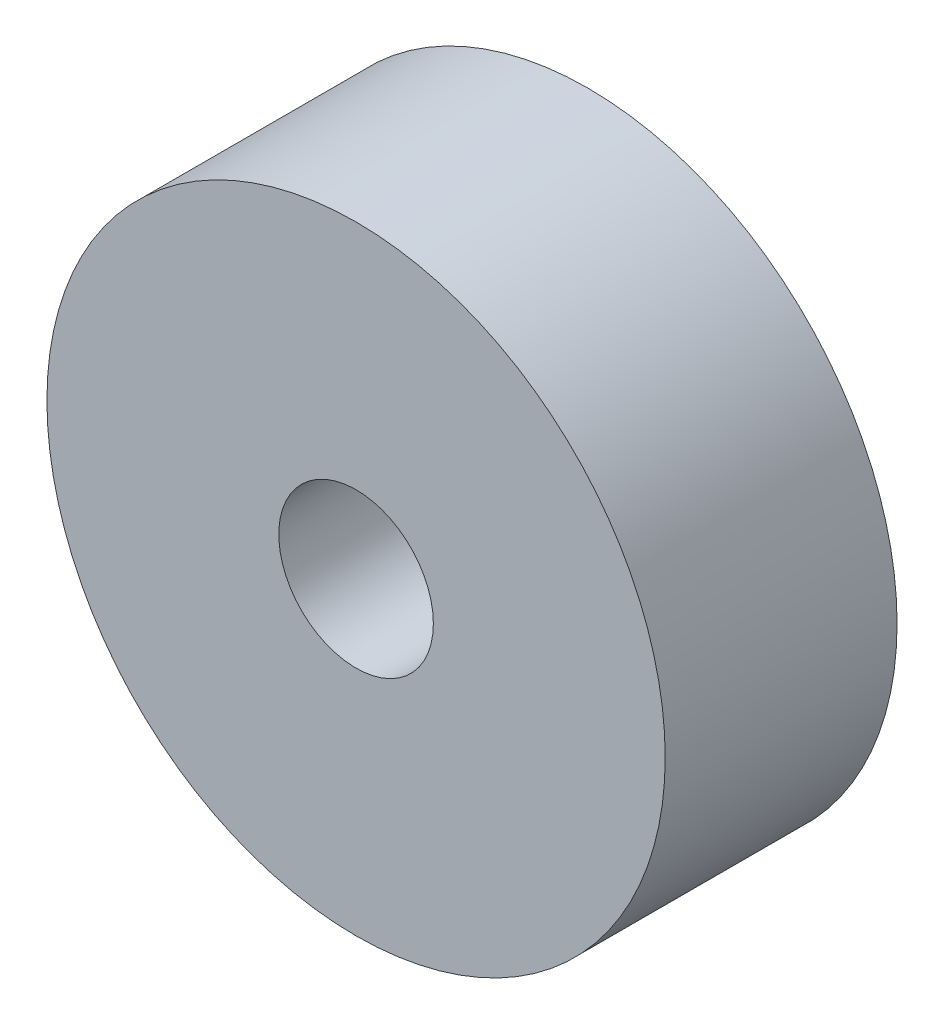
from build123d import *

# Parameters (mm, degrees)
SKETCH1_R           = 4
BOSS_EXTRUDE1_DEPTH = 3
SKETCH2_R           = 1
CUT_EXTRUDE1_DEPTH  = 3


with BuildPart() as part:
    # Sketch1 → Boss-Extrude1 (new body)
    with BuildSketch(Plane.XY):
        Circle(SKETCH1_R)
    extrude(amount=BOSS_EXTRUDE1_DEPTH)

    # Sketch2 → Cut-Extrude1 (cut)
    with BuildSketch(Plane.XY.offset(3)):
        Circle(SKETCH2_R)
    extrude(amount=-CUT_EXTRUDE1_DEPTH, mode=Mode.SUBTRACT)


solid = part.part
